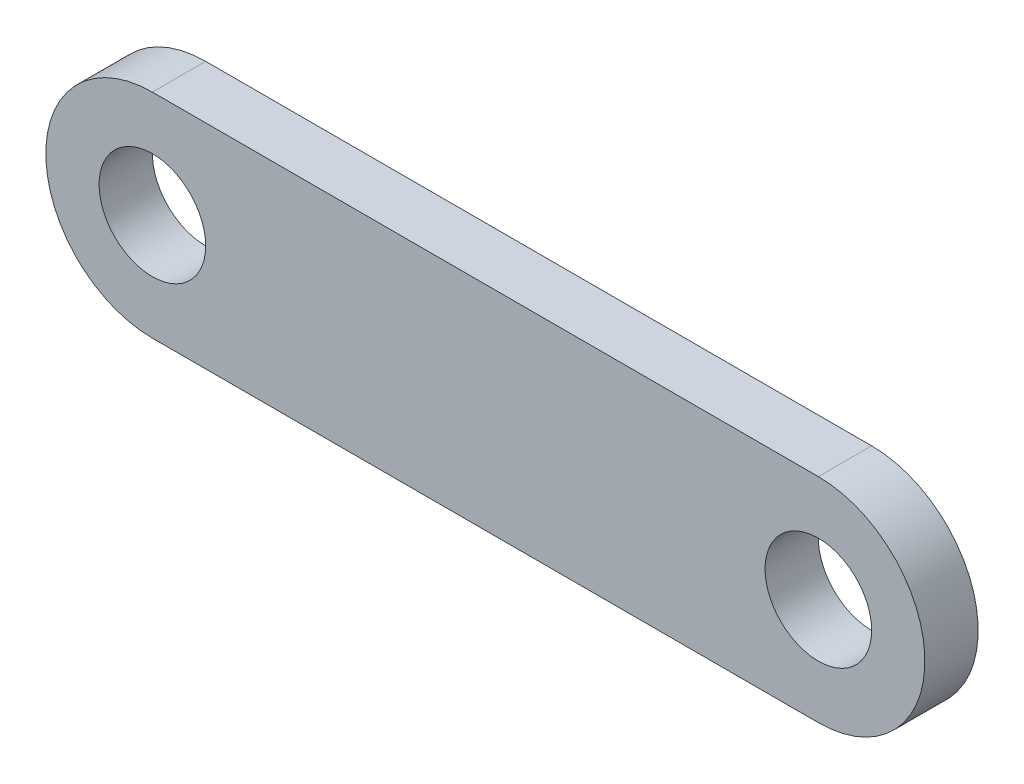
from build123d import *

# Parameters (mm, degrees)
SKETCH1_R           = 5
BOSS_EXTRUDE1_DEPTH = 2.5


with BuildPart() as part:
    # Sketch1 → Boss-Extrude1 (new, symmetric)
    with BuildSketch(Plane.XY):
        with BuildLine():
            Line((0, -10), (-62.5, -10))
            ThreePointArc((-62.5, -10), (-72.5, 0), (-62.5, 10))
            Line((-62.5, 10), (0, 10))
            ThreePointArc((0, 10), (10, 0), (0, -10))
        make_face()
        with Locations((-62.5, 0)):
            Circle(SKETCH1_R, mode=Mode.SUBTRACT)
        Circle(SKETCH1_R, mode=Mode.SUBTRACT)
    extrude(amount=BOSS_EXTRUDE1_DEPTH, both=True)


solid = part.part
